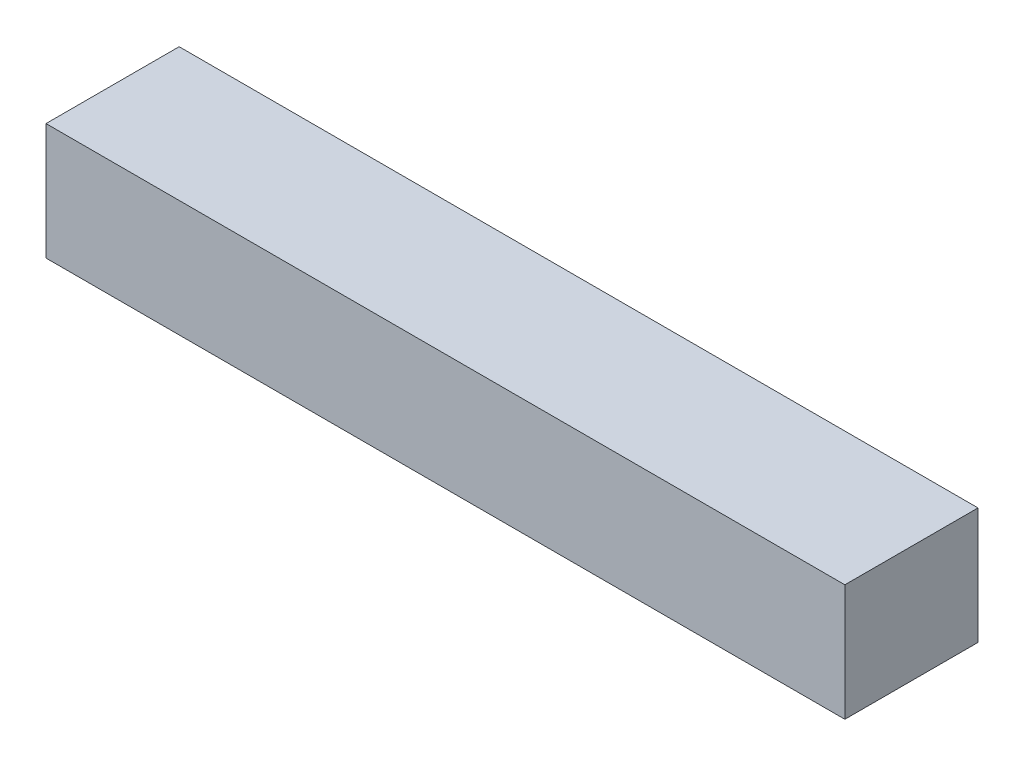
from build123d import *

# Parameters (mm, degrees)
SKETCH1_W           = 304.8
SKETCH1_H           = 50.8
BOSS_EXTRUDE1_DEPTH = 44.45


with BuildPart() as part:
    # Sketch1 → Boss-Extrude1 (new body)
    with BuildSketch(Plane(origin=(0, 0, 0), x_dir=(1, 0, 0), z_dir=(0, 1, 0))):
        with Locations((152.4, 25.4)):
            Rectangle(SKETCH1_W, SKETCH1_H)
    extrude(amount=BOSS_EXTRUDE1_DEPTH)


solid = part.part
